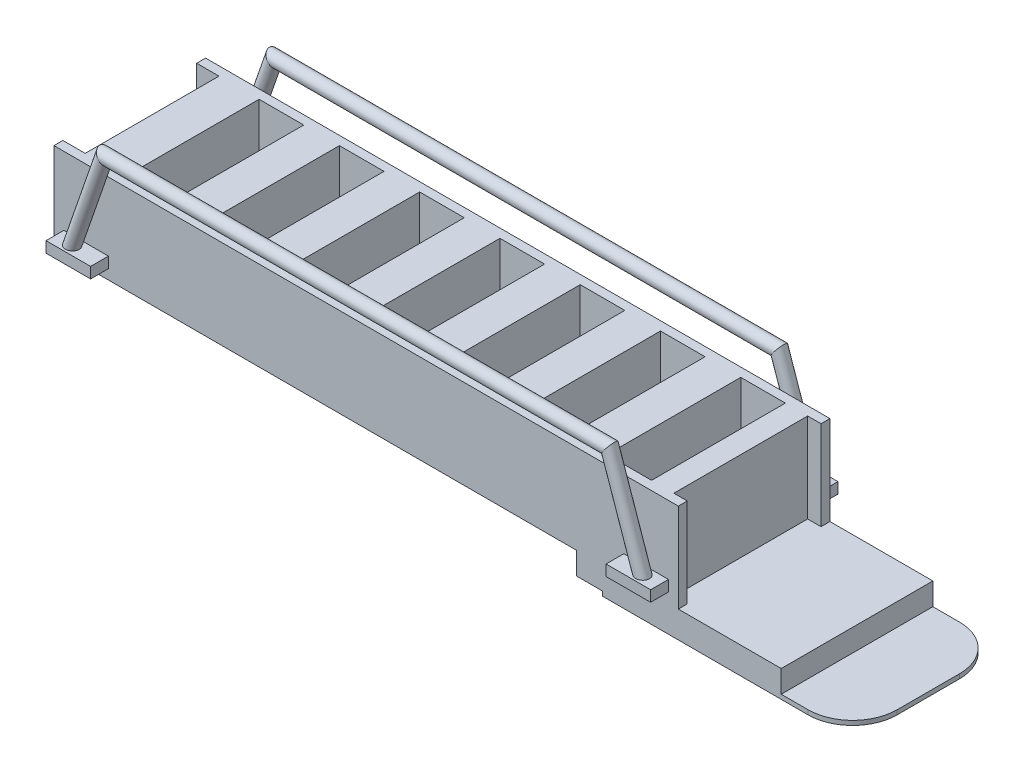
from build123d import *

# Parameters (mm, degrees)
SKETCH1_W                = 140
SKETCH1_H                = 2
BOSS_EXTRUDE3_DEPTH      = 20
SKETCH3_W                = 8
SKETCH3_H                = 20
SKETCH3_W_2              = 9
BOSS_EXTRUDE4_DEPTH      = 30
SKETCH4_W                = 140
SKETCH4_H                = 20
BOSS_EXTRUDE6_DEPTH      = 2
SKETCH6_W                = 30
SKETCH6_H                = 20
CUT_EXTRUDE4_DEPTH       = 3
SKETCH8_W                = 45.941462796
SKETCH8_H                = 34
BOSS_EXTRUDE7_DEPTH      = 5
SKETCH9_W                = 10
SKETCH9_H                = 2.440826928
BOSS_EXTRUDE8_DEPTH      = 4
SWEEP4_PROFILE_R         = 1.5
MIRROR10_COPY_1_SKETCH_W = 10
MIRROR10_COPY_1_SKETCH_H = 2.440826928
MIRROR10_COPY_1_DEPTH    = 4
MIRROR10_COPY_2_SKETCH_R = 1.5
SKETCH75_W               = 56.059600345
SKETCH75_H               = 34
BOSS_EXTRUDE11_DEPTH     = 1
SKETCH84_R               = 2.5
BOSS_EXTRUDE12_DEPTH     = 10
FILLET1_R                = 10


with BuildPart() as part:
    # Sketch1 → Boss-Extrude3 (new body)
    with BuildSketch(Plane(origin=(0, 0, 0), x_dir=(1, 0, 0), z_dir=(0, 1, 0))):
        with Locations((70, 1)):
            Rectangle(SKETCH1_W, SKETCH1_H)
    extrude(amount=BOSS_EXTRUDE3_DEPTH)

    # Sketch3 → Boss-Extrude4 (add)
    with BuildSketch(Plane(origin=(0, 0, -2), x_dir=(-1, 0, 0), z_dir=(0, 0, -1))):
        with Locations((-136, 10)):
            Rectangle(SKETCH3_W, SKETCH3_H)
        with Locations((-118, 10)):
            Rectangle(SKETCH3_W, SKETCH3_H)
        with Locations((-100, 10)):
            Rectangle(SKETCH3_W, SKETCH3_H)
        with Locations((-82, 10)):
            Rectangle(SKETCH3_W, SKETCH3_H)
        with Locations((-64, 10)):
            Rectangle(SKETCH3_W, SKETCH3_H)
        with Locations((-46, 10)):
            Rectangle(SKETCH3_W, SKETCH3_H)
        with Locations((-28, 10)):
            Rectangle(SKETCH3_W, SKETCH3_H)
        with Locations((-9.5, 10)):
            Rectangle(SKETCH3_W_2, SKETCH3_H)
    extrude(amount=BOSS_EXTRUDE4_DEPTH)

    # Sketch4 → Boss-Extrude6 (add)
    with BuildSketch(Plane(origin=(0, 0, -32), x_dir=(-1, 0, 0), z_dir=(0, 0, -1))):
        with Locations((-70, 10)):
            Rectangle(SKETCH4_W, SKETCH4_H)
    extrude(amount=BOSS_EXTRUDE6_DEPTH)

    # Sketch6 → Cut-Extrude4 (cut)
    with BuildSketch(Plane(origin=(140, 0, 0), x_dir=(0, 0, -1), z_dir=(1, 0, 0))):
        with Locations((17, 10)):
            Rectangle(SKETCH6_W, SKETCH6_H)
    extrude(amount=-CUT_EXTRUDE4_DEPTH, mode=Mode.SUBTRACT)

    # Sketch8 → Boss-Extrude7 (add)
    with BuildSketch(Plane.XZ):
        with Locations((140.102979593, -17)):
            Rectangle(SKETCH8_W, SKETCH8_H)
    extrude(amount=BOSS_EXTRUDE7_DEPTH)

    # Sketch9 → Boss-Extrude8 (add)
    with BuildSketch(Plane.XY):
        with Locations((7.209980337, 3.43195512)):
            Rectangle(SKETCH9_W, SKETCH9_H)
    boss_extrude8 = extrude(amount=BOSS_EXTRUDE8_DEPTH)

    # Sweep4: sweep along a path in Sketch35
    with BuildLine(Plane.XY.offset(2)) as sweep4_path:
        Line((5.644054271, 3.447454854), (13.359758823, 25.754529488))
        Line((13.359758823, 25.754529488), (70, 25.754529488))
    # Sweep4 profile (on start of the path) → Sweep4 (sweep)
    with BuildSketch(Plane(origin=(5.644054271, 3.447454854, 2), x_dir=(0.9450642967083543, -0.3268844980832583, 0), z_dir=(0.3268844980832583, 0.9450642967083543, 0))):
        Circle(SWEEP4_PROFILE_R)
    sweep4 = sweep(path=sweep4_path.line, transition=Transition.RIGHT)

    # Mirror9: Boss-Extrude8, Sweep4 across plane
    add(boss_extrude8.mirror(Plane(origin=(70, 0, 0), x_dir=(0, 0, 1), z_dir=(1, 0, 0))))
    add(sweep4.mirror(Plane(origin=(70, 0, 0), x_dir=(0, 0, 1), z_dir=(1, 0, 0))))

    # Mirror10: Boss-Extrude8, Sweep4 across plane
    add(boss_extrude8.mirror(Plane.XY.offset(-17)))
    add(sweep4.mirror(Plane.XY.offset(-17)))

    # Mirror10 copy 1 sketch → Mirror10 copy 1 (add)
    with BuildSketch(Plane(origin=(140, 0, -34), x_dir=(-1, 0, 0), z_dir=(0, 0, -1))):
        with Locations((7.209980337, 3.43195512)):
            Rectangle(MIRROR10_COPY_1_SKETCH_W, MIRROR10_COPY_1_SKETCH_H)
    extrude(amount=MIRROR10_COPY_1_DEPTH)

    # Mirror10 copy 2: sweep along a path in Mirror10 copy 2 path
    with BuildLine(Plane(origin=(140, 0, -36), x_dir=(-1, 0, 0), z_dir=(0, 0, -1))) as mirror10_copy_2_path:
        Line((5.644054271, 3.447454854), (13.359758823, 25.754529488))
        Line((13.359758823, 25.754529488), (70, 25.754529488))
    # Mirror10 copy 2 sketch → Mirror10 copy 2 (sweep)
    with BuildSketch(Plane(origin=(134.355945729, 3.447454854, -36), x_dir=(-0.9450642967083543, -0.3268844980832583, 0), z_dir=(-0.3268844980832583, 0.9450642967083543, 0))):
        Circle(MIRROR10_COPY_2_SKETCH_R)
    sweep(path=mirror10_copy_2_path.line, transition=Transition.RIGHT)

    # Sketch75 → Boss-Extrude11 (add)
    with BuildSketch(Plane.XZ.offset(5)):
        with Locations((151.050400416, -17)):
            Rectangle(SKETCH75_W, SKETCH75_H)
    extrude(amount=BOSS_EXTRUDE11_DEPTH)

    # Sketch84 → Boss-Extrude12 (add)
    with BuildSketch(Plane.XZ.offset(6)):
        with Locations(Location((165.821290963, -17, 0), (0, 0, 270))):
            Circle(SKETCH84_R)
    extrude(amount=BOSS_EXTRUDE12_DEPTH)

    # Fillet1
    fillet1_edges = [part.edges().sort_by_distance(p)[0] for p in [
        (179.080200588, -5.5, -34),
        (179.080200588, -5.5, 0),
    ]]
    fillet(fillet1_edges, radius=FILLET1_R)


solid = part.part
